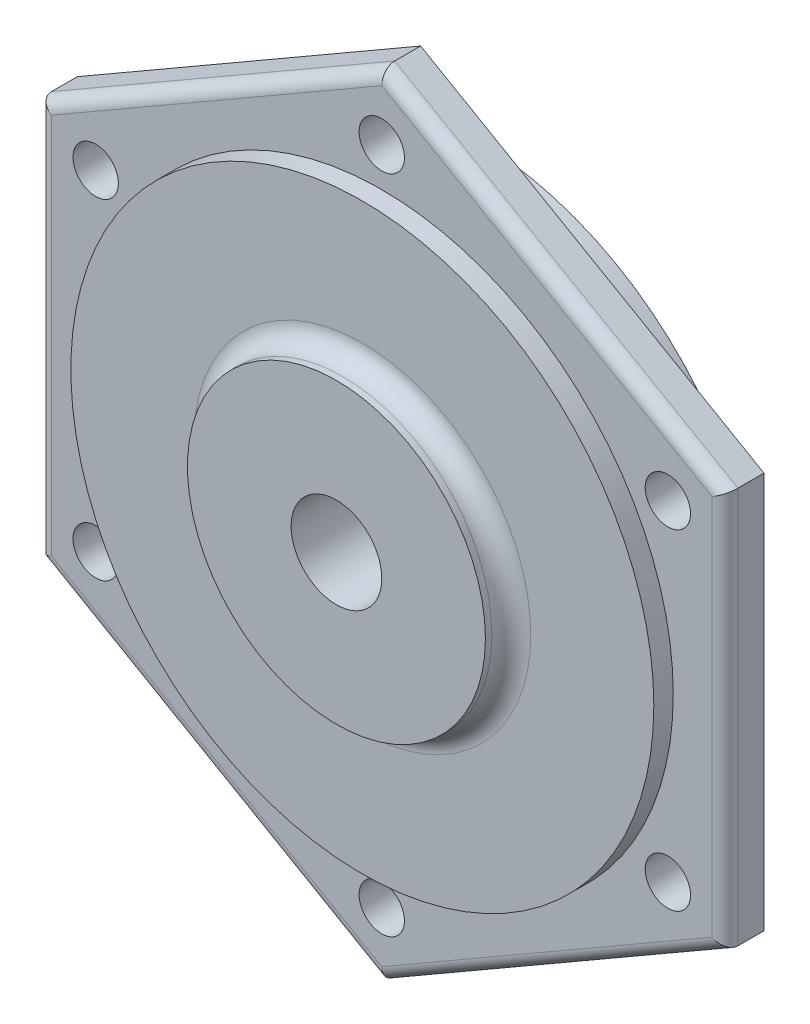
from build123d import *

# Parameters (mm, degrees)
BOSS_EXTRUDE1_DEPTH = 6
SKETCH3_R           = 3.5
SKETCH3_R_2         = 7
CUT_EXTRUDE1_DEPTH  = 83.160412203
FILLET1_R           = 2


with BuildPart() as part:
    # Sketch1 → Revolve1 (revolve)
    with BuildSketch(Plane(origin=(0, 0, 0), x_dir=(0, 0, -1), z_dir=(1, 0, 0)), mode=Mode.PRIVATE) as revolve1_sk:
        with BuildLine():
            Line((-3, 45), (-3, 26))
            ThreePointArc((-3, 26), (-3.878679656, 23.878679656), (-6, 23))
            Line((-6, 23), (-7, 23))
            Line((-7, 23), (-7, 7))
            Line((-7, 7), (0, 7))
            Line((0, 7), (0, 19))
            Line((0, 19), (8, 19))
            Line((8, 19), (8, 40))
            Line((8, 40), (14, 40))
            Line((14, 40), (14, 45))
            Line((14, 45), (3, 45))
            Line((3, 45), (-3, 45))
        make_face()
    revolve(revolve1_sk.sketch.rotate(Axis((0, 0, 21.063158719), (0, 0, -1)), 90), axis=Axis((0, 0, 21.063158719), (0, 0, -1)))

    # Sketch2 → Boss-Extrude1 (add)
    with BuildSketch(Plane.XY):
        Polygon((0, 61.199128534), (-53, 30.599564267), (-53, -30.599564267), (0, -61.199128534), (53, -30.599564267), (53, 30.599564267), align=None)
    extrude(amount=-BOSS_EXTRUDE1_DEPTH)

    # Sketch3 → Cut-Extrude1 (cut, through all)
    with BuildSketch(Plane.XY):
        with Locations((0, 51)):
            Circle(SKETCH3_R)
        with Locations((44.167295593, 25.5)):
            Circle(SKETCH3_R)
        with Locations((44.167295593, -25.5)):
            Circle(SKETCH3_R)
        with Locations((0, -51)):
            Circle(SKETCH3_R)
        with Locations((-44.167295593, -25.5)):
            Circle(SKETCH3_R)
        with Locations((-44.167295593, 25.5)):
            Circle(SKETCH3_R)
        Circle(SKETCH3_R_2)
    extrude(amount=-CUT_EXTRUDE1_DEPTH, mode=Mode.SUBTRACT)

    # Fillet1
    fillet1_edges = [part.edges().sort_by_distance(p)[0] for p in [
        (26.5, 45.899346401, 0),
        (-26.5, 45.899346401, 0),
        (-53, 0, 0),
        (-26.5, -45.899346401, 0),
        (26.5, -45.899346401, 0),
        (53, 0, 0),
    ]]
    fillet(fillet1_edges, radius=FILLET1_R)


solid = part.part
